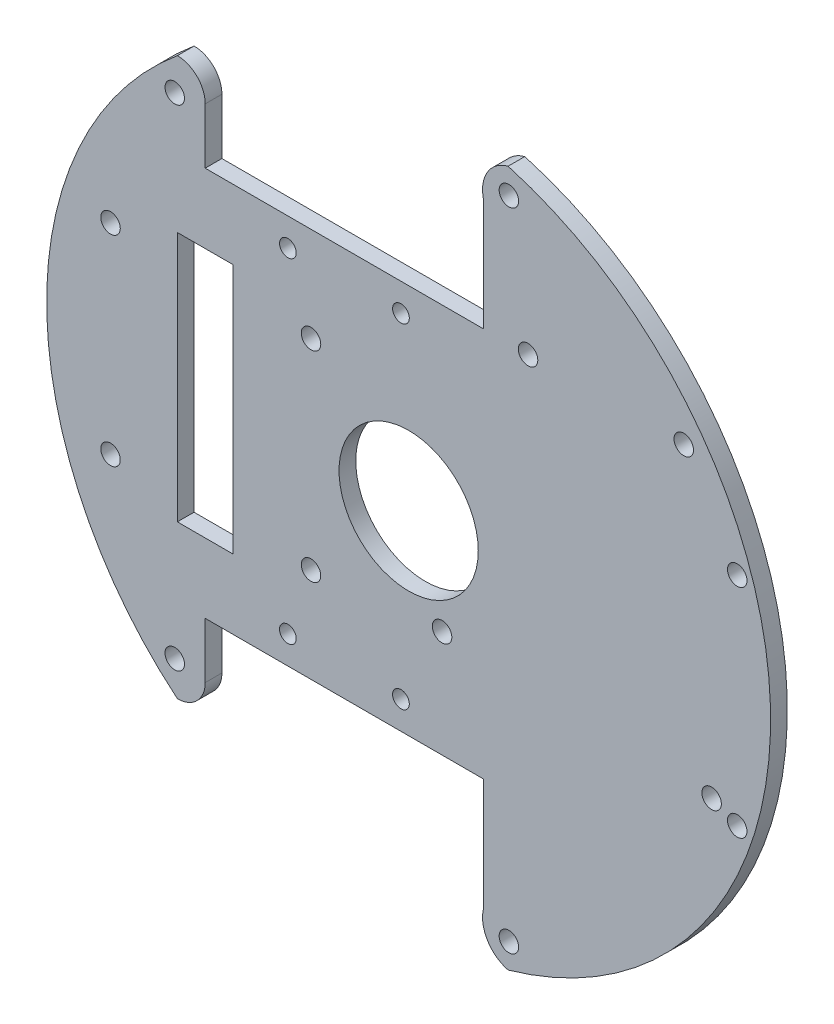
from build123d import *

# Parameters (mm, degrees)
SALIENTE_EXTRUIR1_DEPTH = 3
CROQUIS2_R              = 12.5
CROQUIS2_W              = 10
CROQUIS2_H              = 45
CORTAR_EXTRUIR1_DEPTH   = 3
CROQUIS4_R              = 1.75
CORTAR_EXTRUIR2_DEPTH   = 3
CROQUIS5_R              = 1.75
CORTAR_EXTRUIR3_DEPTH   = 3
CROQUIS6_R              = 1.75
CORTAR_EXTRUIR4_DEPTH   = 3
CROQUIS7_R              = 1.5
CORTAR_EXTRUIR5_DEPTH   = 10
CROQUIS8_R              = 1.75
CORTAR_EXTRUIR6_DEPTH   = 10


with BuildPart() as part:
    # Croquis1 → Saliente-Extruir1 (new body)
    with BuildSketch(Plane.XY):
        with BuildLine():
            Line((-41.533119315, 0), (-41.533119315, 50))
            ThreePointArc((-41.533119315, 50), (-58.84153616, 27.616546168), (-65, 0))
            Line((-65, 0), (-41.533119315, 0))
        make_face()
        with BuildLine():
            Line((-41.533119315, -50), (-41.533119315, 0))
            Line((-41.533119315, 0), (-65, 0))
            ThreePointArc((-65, 0), (-58.84153616, -27.616546168), (-41.533119315, -50))
        make_face()
        with BuildLine():
            Line((17.853571071, 0), (-41.533119315, 0))
            Line((-41.533119315, 0), (-41.533119315, -50))
            ThreePointArc((-41.533119315, -50), (-37.997585409, -48.535533906), (-36.533119315, -45))
            Line((-36.533119315, -45), (-36.533119315, -35))
            Line((-36.533119315, -35), (13.466880685, -35))
            Line((13.466880685, -35), (13.466880685, -55))
            ThreePointArc((13.466880685, -55), (14.106925019, -59.658513326), (17.853571071, -62.5))
            Line((17.853571071, -62.5), (17.853571071, 0))
        make_face()
        with BuildLine():
            ThreePointArc((-36.533119315, 45), (-37.997585409, 48.535533906), (-41.533119315, 50))
            Line((-41.533119315, 50), (-41.533119315, 0))
            Line((-41.533119315, 0), (17.853571071, 0))
            Line((17.853571071, 0), (17.853571071, 62.5))
            ThreePointArc((17.853571071, 62.5), (14.106925019, 59.658513326), (13.466880685, 55))
            Line((13.466880685, 55), (13.466880685, 35))
            Line((13.466880685, 35), (-36.533119315, 35))
            Line((-36.533119315, 35), (-36.533119315, 45))
        make_face()
        with BuildLine():
            ThreePointArc((65, 0), (51.891628032, 39.144079248), (17.853571071, 62.5))
            Line((17.853571071, 62.5), (17.853571071, 0))
            Line((17.853571071, 0), (65, 0))
        make_face()
        with BuildLine():
            Line((65, 0), (17.853571071, 0))
            Line((17.853571071, 0), (17.853571071, -62.5))
            ThreePointArc((17.853571071, -62.5), (51.891628032, -39.144079248), (65, 0))
        make_face()
    extrude(amount=SALIENTE_EXTRUIR1_DEPTH)

    # Croquis2 → Cortar-Extruir1 (cut)
    with BuildSketch(Plane.XY.offset(3)):
        Circle(CROQUIS2_R)
        with Locations((-36.533119315, 0)):
            Rectangle(CROQUIS2_W, CROQUIS2_H)
    extrude(amount=-CORTAR_EXTRUIR1_DEPTH, mode=Mode.SUBTRACT)

    # Croquis4 → Cortar-Extruir2 (cut)
    with BuildSketch(Plane.XY.offset(3)):
        with Locations((-53.533119315, 18)):
            Circle(CROQUIS4_R)
        with Locations((-17.533119315, 18)):
            Circle(CROQUIS4_R)
        with Locations(Location((-17.533119315, -18, 0), (0, 0, 180))):
            Circle(CROQUIS4_R)
        with Locations(Location((-53.533119315, -18, 0), (0, 0, 180))):
            Circle(CROQUIS4_R)
    extrude(amount=-CORTAR_EXTRUIR2_DEPTH, mode=Mode.SUBTRACT)

    # Croquis5 → Cortar-Extruir3 (cut)
    with BuildSketch(Plane.XY.offset(3)):
        with Locations((-42, 44)):
            Circle(CROQUIS5_R)
        with Locations((18, 58)):
            Circle(CROQUIS5_R)
        with Locations(Location((18, -58, 0), (0, 0, 180))):
            Circle(CROQUIS5_R)
        with Locations(Location((-42, -44, 0), (0, 0, 180))):
            Circle(CROQUIS5_R)
    extrude(amount=-CORTAR_EXTRUIR3_DEPTH, mode=Mode.SUBTRACT)

    # Croquis6 → Cortar-Extruir4 (cut)
    with BuildSketch(Plane.XY.offset(3)):
        with Locations((6, -15.81)):
            Circle(CROQUIS6_R)
        with Locations((54.4, -17.52)):
            Circle(CROQUIS6_R)
        with Locations((49.4, 35)):
            Circle(CROQUIS6_R)
        with Locations((21.44, 35)):
            Circle(CROQUIS6_R)
    extrude(amount=-CORTAR_EXTRUIR4_DEPTH, mode=Mode.SUBTRACT)

    # Croquis7 → Cortar-Extruir5 (cut)
    with BuildSketch(Plane.XY.offset(3)):
        with Locations((-21.683119315, -30)):
            Circle(CROQUIS7_R)
        with Locations((-1.383119315, -30)):
            Circle(CROQUIS7_R)
        with Locations((-1.383119315, 30)):
            Circle(CROQUIS7_R)
        with Locations((-21.683119315, 30)):
            Circle(CROQUIS7_R)
    extrude(amount=-CORTAR_EXTRUIR5_DEPTH, mode=Mode.SUBTRACT)

    # Croquis8 → Cortar-Extruir6 (cut)
    with BuildSketch(Plane.XY.offset(3)):
        with Locations((59, 19.5)):
            Circle(CROQUIS8_R)
        with Locations((59, -19.5)):
            Circle(CROQUIS8_R)
    extrude(amount=-CORTAR_EXTRUIR6_DEPTH, mode=Mode.SUBTRACT)


solid = part.part
